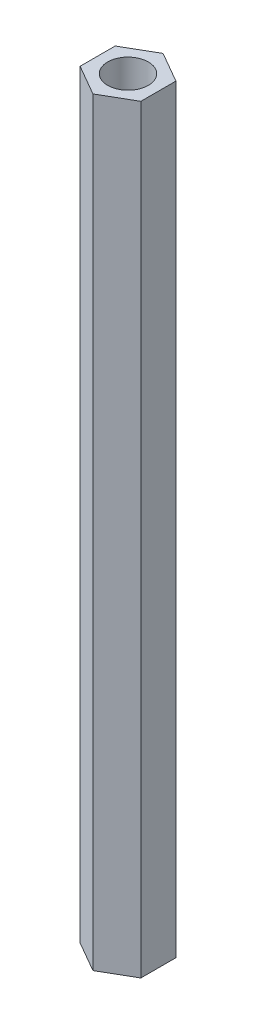
from build123d import *

# Parameters (mm, degrees)
SKETCH1_R           = 1.190625
BOSS_EXTRUDE1_DEPTH = 44.45


with BuildPart() as part:
    # Sketch1 → Boss-Extrude1 (new body)
    with BuildSketch(Plane(origin=(0, 0, 0), x_dir=(1, 0, 0), z_dir=(0, 1, 0))):
        Polygon((0, -2.053057557), (1.778, -1.026528779), (1.778, 1.026528779), (0, 2.053057557), (-1.778, 1.026528779), (-1.778, -1.026528779), align=None)
        with Locations(Location((0, 0, 0), (0, 0, 270))):
            Circle(SKETCH1_R, mode=Mode.SUBTRACT)
    extrude(amount=BOSS_EXTRUDE1_DEPTH)


solid = part.part
